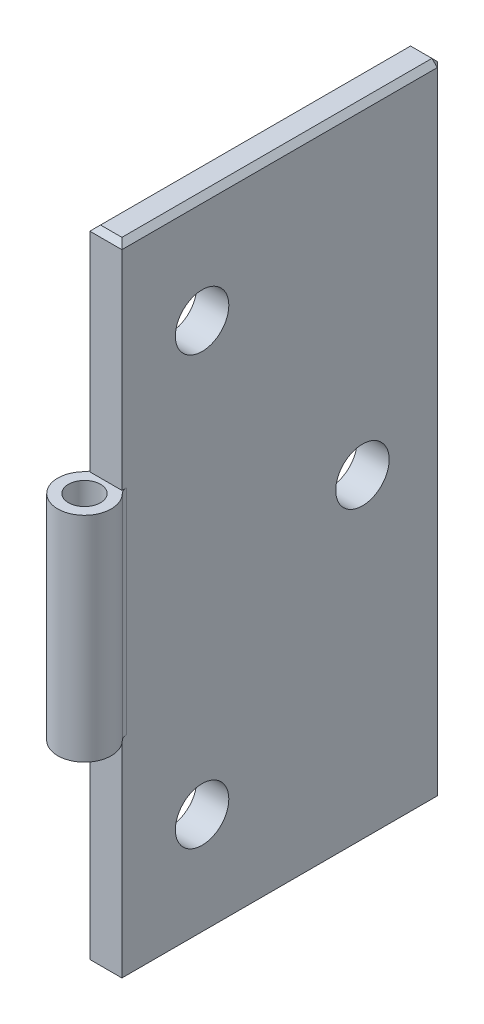
from build123d import *

# Parameters (mm, degrees)
SKETCH1_W           = 30
SKETCH1_H           = 60
SKETCH1_R           = 2.5
BOSS_EXTRUDE1_DEPTH = 1.5
BOSS_EXTRUDE2_START = -20
SKETCH3_R           = 1.5
BOSS_EXTRUDE2_DEPTH = 20
FILLET2_R           = 1
CHAMFER2_SIZE       = 0.5


with BuildPart() as part:
    # Sketch1 → Boss-Extrude1 (new, symmetric)
    with BuildSketch(Plane(origin=(0, 0, 0), x_dir=(0, 0, -1), z_dir=(1, 0, 0))):
        Rectangle(SKETCH1_W, SKETCH1_H)
        with Locations((-7.5, 20)):
            Circle(SKETCH1_R, mode=Mode.SUBTRACT)
        with Locations((7.5, 0)):
            Circle(SKETCH1_R, mode=Mode.SUBTRACT)
        with Locations((-7.5, -20)):
            Circle(SKETCH1_R, mode=Mode.SUBTRACT)
    extrude(amount=BOSS_EXTRUDE1_DEPTH, both=True)

    # Sketch3 → Boss-Extrude2 (add)
    with BuildSketch(Plane(origin=(0, 30, 0), x_dir=(1, 0, 0), z_dir=(0, 1, 0)).offset(BOSS_EXTRUDE2_START)):
        with BuildLine():
            Line((-1.5, -15), (1.5, -15))
            ThreePointArc((1.5, -15), (0, -19.5), (-1.5, -15))
        make_face()
        with Locations(Location((0, -17, 0), (0, 0, 270))):
            Circle(SKETCH3_R, mode=Mode.SUBTRACT)
    extrude(amount=-BOSS_EXTRUDE2_DEPTH)

    # Fillet2
    fillet2_edges = [part.edges().sort_by_distance(p)[0] for p in [
        (1.5, 0, 15),
        (-1.5, 0, 15),
    ]]
    fillet(fillet2_edges, radius=FILLET2_R)

    # Chamfer2
    chamfer2_edges = [part.edges().sort_by_distance(p)[0] for p in [
        (1.5, 0, -15),
        (1.5, 30, 0),
        (-1.5, 30, 0),
        (-1.5, 0, -15),
        (-1.5, -30, 0),
        (1.5, -30, 0),
        (0, 30, 15),
        (0, 30, -15),
        (0, -30, -15),
        (0, -30, 15),
    ]]
    chamfer(chamfer2_edges, length=CHAMFER2_SIZE)


solid = part.part
